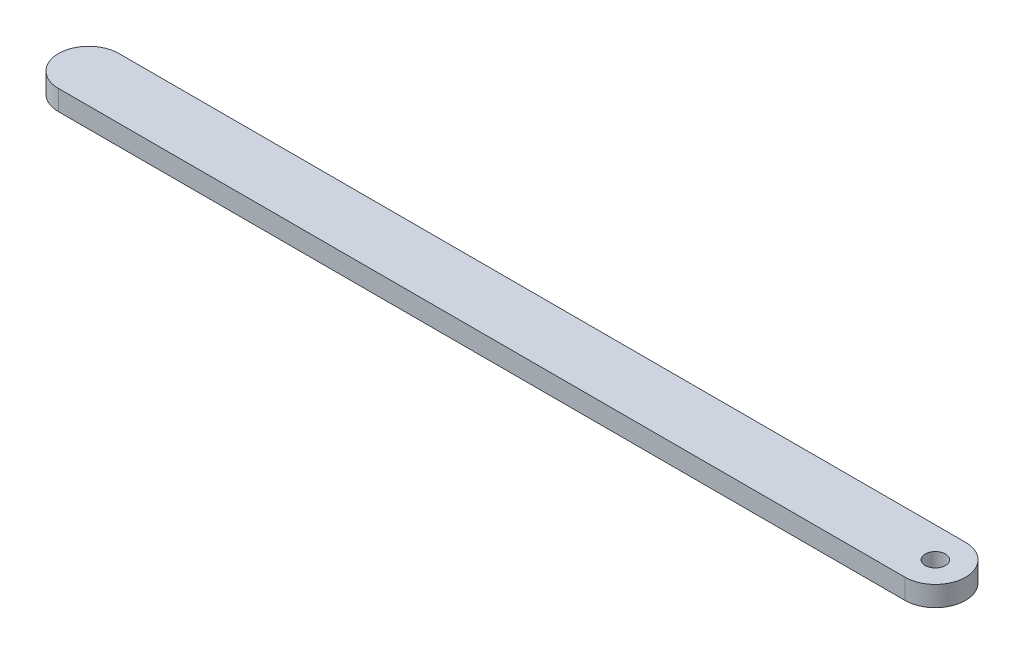
from build123d import *

# Parameters (mm, degrees)
SKETCH1_W           = 114.3
SKETCH1_H           = 7.62
BOSS_EXTRUDE1_DEPTH = 2.54
FILLET1_RADIUS      = 3.81
FILLET1_LENGTH      = 2.54
FILLET4_RADIUS      = 3.81
FILLET4_LENGTH      = 2.54
SKETCH4_R           = 1.27
CUT_EXTRUDE1_DEPTH  = 2.54
SKETCH6_R           = 0.762
BOSS_EXTRUDE3_DEPTH = 2.54


with BuildPart() as part:
    # Sketch1 → Boss-Extrude1 (new body)
    with BuildSketch(Plane(origin=(0, 0, 0), x_dir=(1, 0, 0), z_dir=(0, 1, 0))):
        Rectangle(SKETCH1_W, SKETCH1_H)
    extrude(amount=BOSS_EXTRUDE1_DEPTH)

    # Fillet1: full round fillet: the end face becomes a half cylinder, R = half its width
    fillet1_face = Plane((57.15, 1.27, 0), x_dir=(0, -1, 0), z_dir=(1, 0, 0))  # on the end face: x along it, z out of the body
    fillet1_slab = fillet1_face.offset(-FILLET1_RADIUS / 2) * Box(FILLET1_LENGTH, 2 * FILLET1_RADIUS, FILLET1_RADIUS, mode=Mode.PRIVATE)  # the body's end, R deep
    fillet1_round = Plane((53.34, 1.27, 0), x_dir=(1, 0, 0), z_dir=(0, -1, 0)) * Cylinder(FILLET1_RADIUS, FILLET1_LENGTH, mode=Mode.PRIVATE)  # its axis R under the face
    add(fillet1_slab - fillet1_round, mode=Mode.SUBTRACT)

    # Fillet4: full round fillet: the end face becomes a half cylinder, R = half its width
    fillet4_face = Plane((-57.15, 1.27, 0), x_dir=(0, 1, 0), z_dir=(-1, 0, 0))  # on the end face: x along it, z out of the body
    fillet4_slab = fillet4_face.offset(-FILLET4_RADIUS / 2) * Box(FILLET4_LENGTH, 2 * FILLET4_RADIUS, FILLET4_RADIUS, mode=Mode.PRIVATE)  # the body's end, R deep
    fillet4_round = Plane((-53.34, 1.27, 0), x_dir=(-1, 0, 0), z_dir=(0, 1, 0)) * Cylinder(FILLET4_RADIUS, FILLET4_LENGTH, mode=Mode.PRIVATE)  # its axis R under the face
    add(fillet4_slab - fillet4_round, mode=Mode.SUBTRACT)

    # Sketch4 → Cut-Extrude1 (cut)
    with BuildSketch(Plane(origin=(0, 0, 0), x_dir=(-1, 0, 0), z_dir=(0, -1, 0))):
        with Locations(Location((-53.34, 0, 0), (0, 0, 90))):
            Circle(SKETCH4_R)
    extrude(amount=-CUT_EXTRUDE1_DEPTH, mode=Mode.SUBTRACT)

    # Sketch6 → Boss-Extrude3 (add)
    with BuildSketch(Plane(origin=(0, 0, 0), x_dir=(-1, 0, 0), z_dir=(0, -1, 0))):
        with Locations(Location((53.234546108, 0, 0), (0, 0, 90))):
            Circle(SKETCH6_R)
    extrude(amount=BOSS_EXTRUDE3_DEPTH)


solid = part.part
